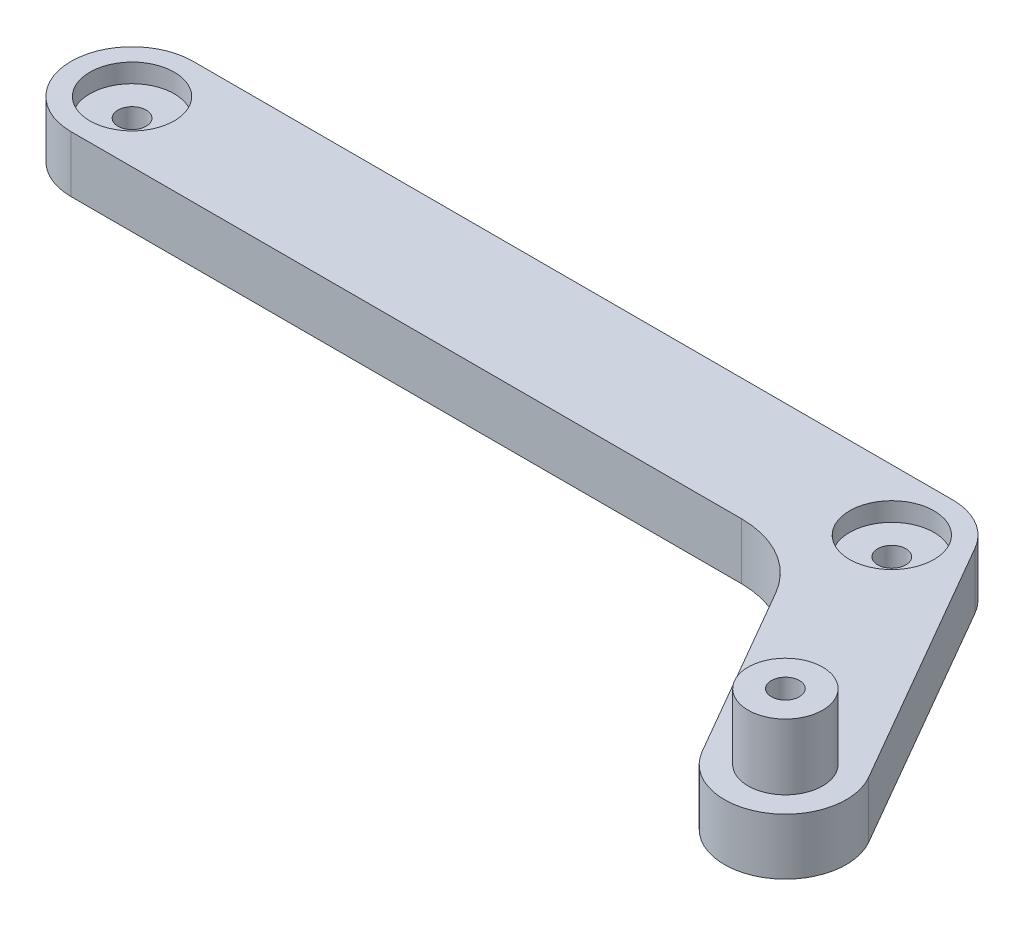
from build123d import *

# Parameters (mm, degrees)
SKETCH1_R           = 1.5
BOSS_EXTRUDE1_DEPTH = 6
SKETCH2_R           = 4.5
CUT_EXTRUDE1_DEPTH  = 2
SKETCH3_R           = 3.975
SKETCH3_R_2         = 1.5
BOSS_EXTRUDE2_DEPTH = 7


with BuildPart() as part:
    # Sketch1 → Boss-Extrude1 (new body)
    with BuildSketch(Plane(origin=(0, 0, 0), x_dir=(1, 0, 0), z_dir=(0, 1, 0))):
        with BuildLine():
            Line((0, 6.5), (81, 6.5))
            ThreePointArc((81, 6.5), (84.25, 5.629165125), (86.629165125, 3.25))
            Line((86.629165125, 3.25), (102.129165125, -23.596787517))
            ThreePointArc((102.129165125, -23.596787517), (99.75, -32.475952642), (90.870834875, -30.096787517))
            Line((90.870834875, -30.096787517), (80.133974596, -11.5))
            ThreePointArc((80.133974596, -11.5), (76.473720558, -7.839745962), (71.473720558, -6.5))
            Line((71.473720558, -6.5), (0, -6.5))
            ThreePointArc((0, -6.5), (-6.5, 0), (0, 6.5))
        make_face()
        with Locations(Location((0, 0, 0), (0, 0, 270))):
            Circle(SKETCH1_R, mode=Mode.SUBTRACT)
        with Locations(Location((81, 0, 0), (0, 0, 270))):
            Circle(SKETCH1_R, mode=Mode.SUBTRACT)
        with Locations(Location((96.5, -26.846787517, 0), (0, 0, 270))):
            Circle(SKETCH1_R, mode=Mode.SUBTRACT)
    extrude(amount=BOSS_EXTRUDE1_DEPTH)

    # Sketch2 → Cut-Extrude1 (cut)
    with BuildSketch(Plane(origin=(0, 6, 0), x_dir=(1, 0, 0), z_dir=(0, 1, 0))):
        with Locations(Location((0, 0, 0), (0, 0, 270))):
            Circle(SKETCH2_R)
        with Locations(Location((81, 0, 0), (0, 0, 270))):
            Circle(SKETCH2_R)
    extrude(amount=-CUT_EXTRUDE1_DEPTH, mode=Mode.SUBTRACT)

    # Sketch3 → Boss-Extrude2 (add)
    with BuildSketch(Plane(origin=(0, 6, 0), x_dir=(1, 0, 0), z_dir=(0, 1, 0))):
        with Locations(Location((96.5, -26.846787517, 0), (0, 0, 270))):
            Circle(SKETCH3_R)
        with Locations(Location((96.5, -26.846787517, 0), (0, 0, 270))):
            Circle(SKETCH3_R_2, mode=Mode.SUBTRACT)
    extrude(amount=BOSS_EXTRUDE2_DEPTH)


solid = part.part
